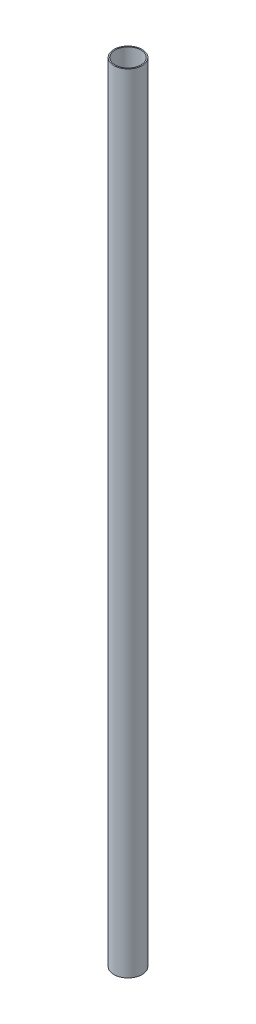
from build123d import *

# Parameters (mm, degrees)
SKETCH1_R           = 12.5
BOSS_EXTRUDE1_DEPTH = 700
SHELL1_T            = -1


with BuildPart() as part:
    # Sketch1 → Boss-Extrude1 (new body)
    with BuildSketch(Plane(origin=(0, 0, 0), x_dir=(1, 0, 0), z_dir=(0, 1, 0))):
        with Locations(Location((0, 0, 0), (0, 0, 270))):
            Circle(SKETCH1_R)
    extrude(amount=BOSS_EXTRUDE1_DEPTH)

    # Shell1
    shell1_openings = [part.faces().sort_by_distance(p)[0] for p in [
        (0, 700, 0),
    ]]
    offset(amount=SHELL1_T, openings=shell1_openings, kind=Kind.INTERSECTION)


solid = part.part
